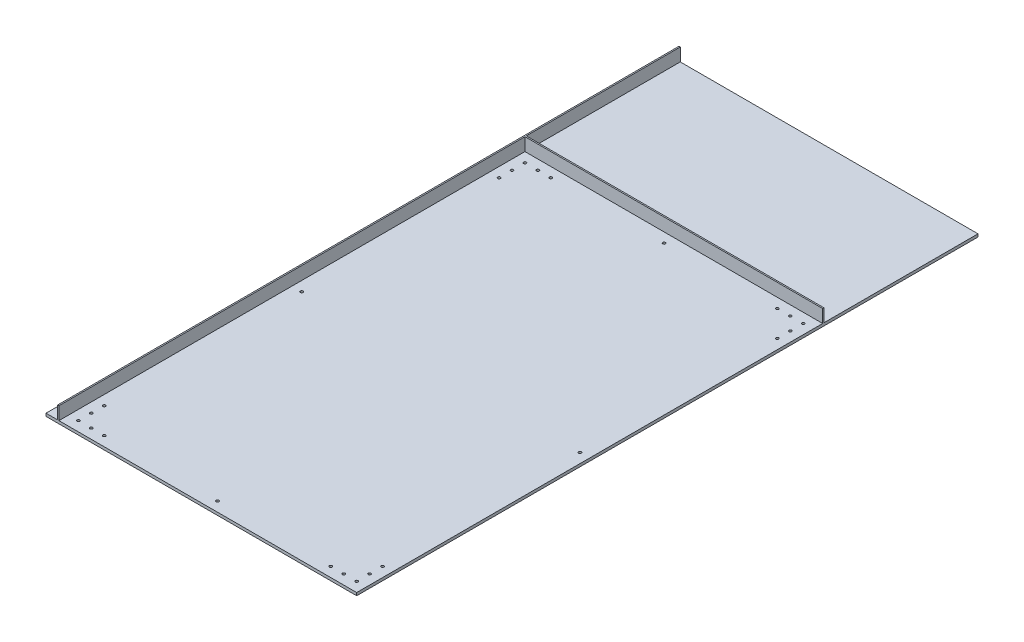
from build123d import *

# Parameters (mm, degrees)
SKETCH1_W                  = 609.6
SKETCH1_H                  = 1219.2
BOSS_EXTRUDE1_DEPTH        = 5.5
SKETCH2_W                  = 584.2
SKETCH2_H                  = 2.54
EXTRUDE_THIN1_DEPTH        = 25.4
SKETCH2_3_W                = 2.54
SKETCH2_3_H                = 1219.2
SKETCH2_3_W_2              = 584.2
SKETCH2_3_H_2              = 2.54
EXTRUDE_THIN2_DEPTH        = 25.4
F_5_3_5_3_DIAMETER_HOLE1_D = 5.3


with BuildPart() as part:
    # Sketch1 → Boss-Extrude1 (new body)
    with BuildSketch(Plane(origin=(0, 0, 0), x_dir=(1, 0, 0), z_dir=(0, 1, 0))):
        Rectangle(SKETCH1_W, SKETCH1_H)
    extrude(amount=BOSS_EXTRUDE1_DEPTH)

    # Sketch2 → Extrude-Thin1 (add)
    with BuildSketch(Plane(origin=(0, 5.5, 0), x_dir=(1, 0, 0), z_dir=(0, 1, 0))):
        with Locations((12.7, 306.07)):
            Rectangle(SKETCH2_W, SKETCH2_H)
    extrude(amount=EXTRUDE_THIN1_DEPTH)

    # Sketch2<3> → Extrude-Thin2 (add)
    with BuildSketch(Plane(origin=(0, 5.5, 0), x_dir=(1, 0, 0), z_dir=(0, 1, 0))):
        with Locations((-280.67, 0)):
            Rectangle(SKETCH2_3_W, SKETCH2_3_H)
        with Locations((12.7, 306.07)):
            Rectangle(SKETCH2_3_W_2, SKETCH2_3_H_2)
    extrude(amount=EXTRUDE_THIN2_DEPTH)

    # Ø5.3 (5.3) Diameter Hole1 (through all)
    with Locations(Plane(origin=(0, 5.5, 0), x_dir=(1, 0, 0), z_dir=(0, 1, 0))):
        with Locations((-260.35, 285.75), (-234.95, 285.75), (-209.55, 285.75), (-260.35, 260.35), (-260.35, 234.95), (12.7, 285.75), (234.95, 285.75), (260.35, 285.75), (285.75, 285.75), (285.75, 260.35), (285.75, 234.95), (-260.35, -152.4), (285.75, -152.4), (-260.35, -539.75), (-260.35, -565.15), (-260.35, -590.55), (-234.95, -590.55), (-209.55, -590.55), (12.7, -590.55), (234.95, -590.55), (260.35, -590.55), (285.75, -590.55), (285.75, -565.15), (285.75, -539.75)):
            Hole(F_5_3_5_3_DIAMETER_HOLE1_D / 2)


solid = part.part
